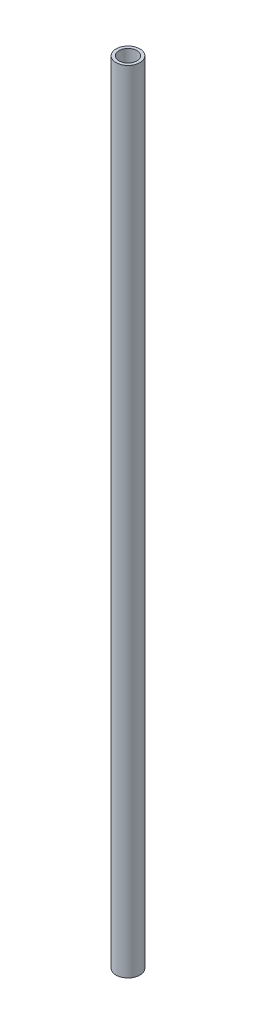
from build123d import *

# Parameters (mm, degrees)
SKETCH_1_R      = 4
SKETCH_1_R_2    = 3
EXTRUDE_1_DEPTH = 265


with BuildPart() as part:
    # 草图1 → 凸台-拉伸1 (new body)
    with BuildSketch(Plane(origin=(0, 0, 0), x_dir=(1, 0, 0), z_dir=(0, 1, 0))):
        with Locations(Location((0, 0, 0), (0, 0, 270))):
            Circle(SKETCH_1_R)
        with Locations(Location((0, 0, 0), (0, 0, 270))):
            Circle(SKETCH_1_R_2, mode=Mode.SUBTRACT)
    extrude(amount=EXTRUDE_1_DEPTH)


solid = part.part
